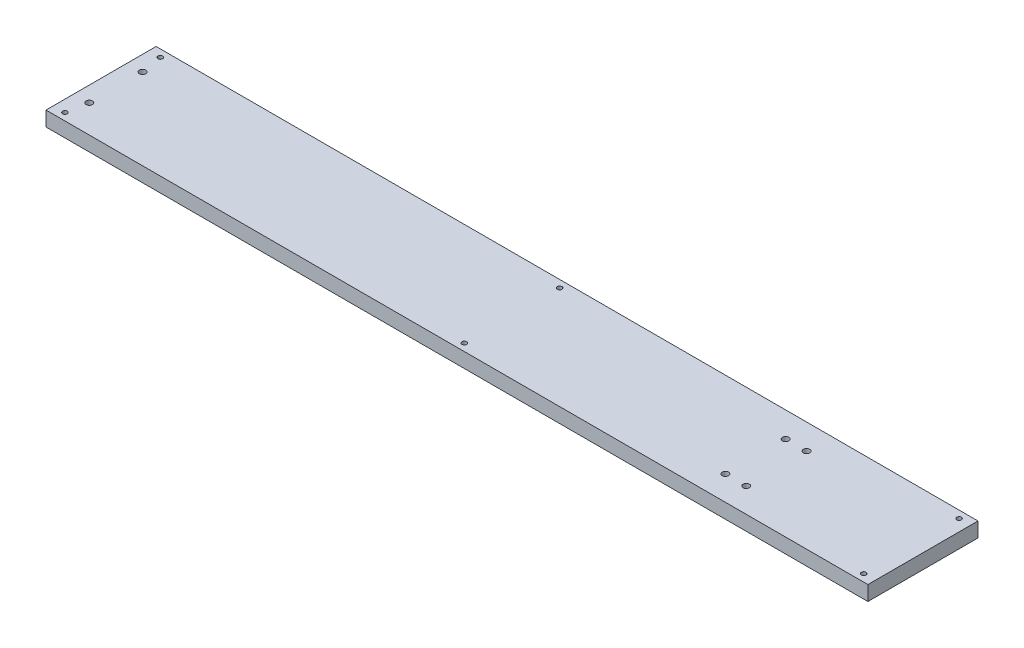
from build123d import *

# Parameters (mm, degrees)
SKETCH1_W           = 709
SKETCH1_H           = 95
BOSS_EXTRUDE1_DEPTH = 12.7
SKETCH2_R           = 2.0195
CUT_EXTRUDE1_DEPTH  = 716.449012858
SKETCH3_R           = 2.75
CUT_EXTRUDE2_DEPTH  = 716.449012858
SKETCH4_R           = 2.75
CUT_EXTRUDE3_DEPTH  = 716.449012858


with BuildPart() as part:
    # Sketch1 → Boss-Extrude1 (new body)
    with BuildSketch(Plane(origin=(0, 0, 0), x_dir=(1, 0, 0), z_dir=(0, 1, 0))):
        with Locations((354.5, 47.5)):
            Rectangle(SKETCH1_W, SKETCH1_H)
    extrude(amount=BOSS_EXTRUDE1_DEPTH)

    # Sketch2 → Cut-Extrude1 (cut, through all)
    with BuildSketch(Plane.XZ):
        with Locations(Location((10, -88.65, 0), (0, 0, 270))):
            Circle(SKETCH2_R)
        with Locations(Location((354.5, -88.65, 0), (0, 0, 270))):
            Circle(SKETCH2_R)
        with Locations(Location((699, -88.65, 0), (0, 0, 270))):
            Circle(SKETCH2_R)
        with Locations(Location((699, -6.35, 0), (0, 0, 270))):
            Circle(SKETCH2_R)
        with Locations(Location((354.5, -6.35, 0), (0, 0, 270))):
            Circle(SKETCH2_R)
        with Locations(Location((10, -6.35, 0), (0, 0, 270))):
            Circle(SKETCH2_R)
    extrude(amount=-CUT_EXTRUDE1_DEPTH, mode=Mode.SUBTRACT)

    # Sketch3 → Cut-Extrude2 (cut, through all)
    with BuildSketch(Plane.XZ):
        with Locations(Location((582.856967806, -21.2158, 0), (0, 0, 270))):
            Circle(SKETCH3_R)
        with Locations(Location((564.856967806, -21.2158, 0), (0, 0, 270))):
            Circle(SKETCH3_R)
        with Locations(Location((564.856967806, -73.2158, 0), (0, 0, 270))):
            Circle(SKETCH3_R)
        with Locations(Location((582.856967806, -73.2158, 0), (0, 0, 270))):
            Circle(SKETCH3_R)
    extrude(amount=-CUT_EXTRUDE2_DEPTH, mode=Mode.SUBTRACT)

    # Sketch4 → Cut-Extrude3 (cut, through all)
    with BuildSketch(Plane.XZ):
        with Locations(Location((13.208, -24.13, 0), (0, 0, 270))):
            Circle(SKETCH4_R)
        with Locations(Location((13.208, -70.108, 0), (0, 0, 270))):
            Circle(SKETCH4_R)
    extrude(amount=-CUT_EXTRUDE3_DEPTH, mode=Mode.SUBTRACT)


solid = part.part
